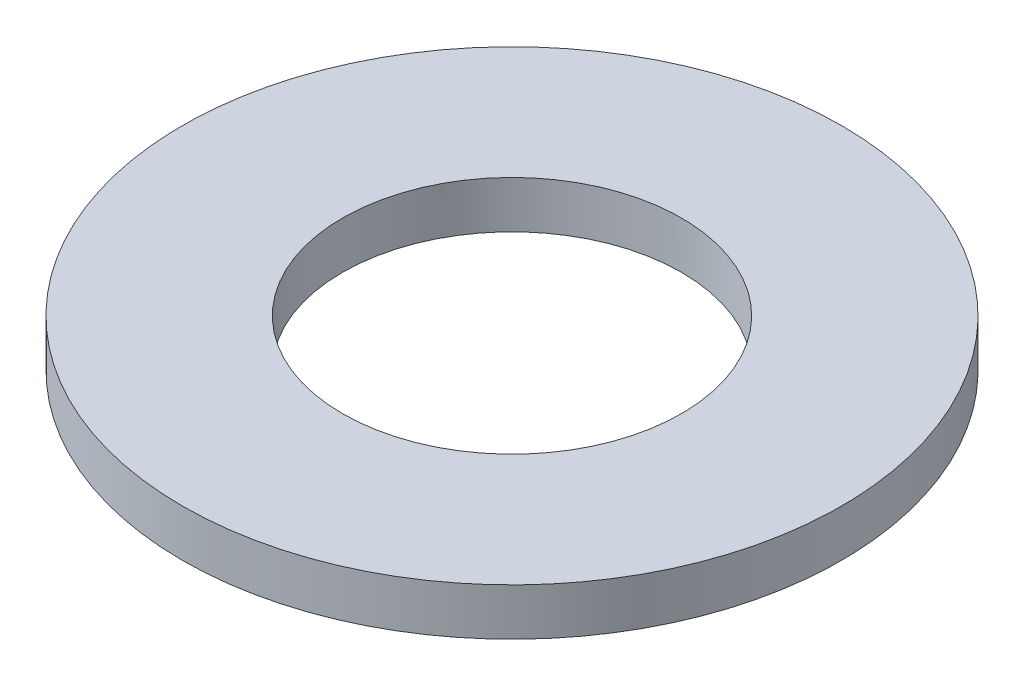
from build123d import *

# Parameters (mm, degrees)
SKETCH1_R               = 1750
BOSS_EXTRUDE1_DEPTH     = 500
SKETCH2_R               = 900
CUT_EXTRUDE2_DEPTH      = 300
SKETCH3_R               = 600
CUT_EXTRUDE3_DEPTH      = 300
SKETCH4_R               = 1700
SKETCH4_R_2             = 950
CUT_EXTRUDE5_DEPTH      = 490
CUT_EXTRUDE6_DEPTH      = 2525.876234591
CUT_EXTRUDE6_DEPTH_BACK = 2525.876234591
SKETCH5_W               = 1750
SKETCH5_H               = 250


with BuildPart() as part:
    # Sketch1 → Boss-Extrude1 (new body)
    with BuildSketch(Plane(origin=(0, 0, 0), x_dir=(1, 0, 0), z_dir=(0, 1, 0))):
        with Locations(Location((0, 0, 0), (0, 0, 270))):
            Circle(SKETCH1_R)
    extrude(amount=BOSS_EXTRUDE1_DEPTH)

    # Sketch2 → Cut-Extrude2 (cut)
    with BuildSketch(Plane(origin=(0, 500, 0), x_dir=(1, 0, 0), z_dir=(0, 1, 0))):
        with Locations(Location((0, 0, 0), (0, 0, 270))):
            Circle(SKETCH2_R)
    extrude(amount=-CUT_EXTRUDE2_DEPTH, mode=Mode.SUBTRACT)

    # Sketch3 → Cut-Extrude3 (cut)
    with BuildSketch(Plane.XZ):
        with Locations(Location((0, 0, 0), (0, 0, 270))):
            Circle(SKETCH3_R)
    extrude(amount=-CUT_EXTRUDE3_DEPTH, mode=Mode.SUBTRACT)

    # Sketch4 → Cut-Extrude5 (cut)
    with BuildSketch(Plane(origin=(0, 0, 0), x_dir=(-1, 0, 0), z_dir=(0, -1, 0))):
        with Locations(Location((0, 0, 0), (0, 0, 90))):
            Circle(SKETCH4_R)
        with Locations(Location((0, 0, 0), (0, 0, 90))):
            Circle(SKETCH4_R_2, mode=Mode.SUBTRACT)
    extrude(amount=-CUT_EXTRUDE5_DEPTH, mode=Mode.SUBTRACT)

    # Sketch5 → Cut-Extrude6 (cut, two sides: drawn at the far end of the back side and taken through both)
    with BuildSketch(Plane.XY.offset(-CUT_EXTRUDE6_DEPTH_BACK)):
        with Locations((-875, 125)):
            Rectangle(SKETCH5_W, SKETCH5_H)
        with Locations((875, 125)):
            Rectangle(SKETCH5_W, SKETCH5_H)
    extrude(amount=CUT_EXTRUDE6_DEPTH + CUT_EXTRUDE6_DEPTH_BACK, mode=Mode.SUBTRACT)


solid = part.part
